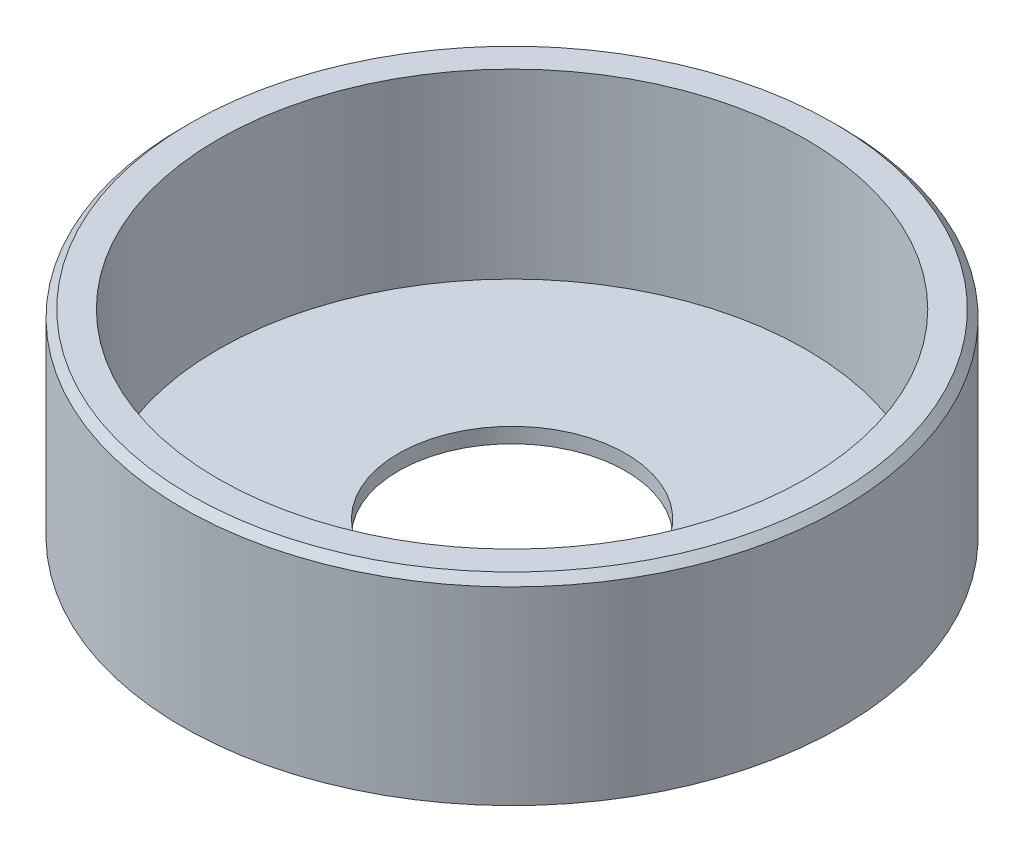
from build123d import *

# Parameters (mm, degrees)
SKETCH_1_R          = 43.5
EXTRUDE_1_DEPTH     = 26
SKETCH_2_R          = 38.8
CUT_EXTRUDE_1_DEPTH = 24
SKETCH_3_R          = 15
CUT_EXTRUDE_2_DEPTH = 67.034082109
CHAMFER_1_SIZE      = 1


with BuildPart() as part:
    # 草图1 → 凸台-拉伸1 (new body)
    with BuildSketch(Plane(origin=(0, 0, 0), x_dir=(1, 0, 0), z_dir=(0, 1, 0))):
        with Locations(Location((0, 0, 0), (0, 0, 90))):
            Circle(SKETCH_1_R)
    extrude(amount=EXTRUDE_1_DEPTH)

    # 草图2 → 切除-拉伸1 (cut)
    with BuildSketch(Plane(origin=(0, 26, 0), x_dir=(1, 0, 0), z_dir=(0, 1, 0))):
        with Locations(Location((0, 0, 0), (0, 0, 270))):
            Circle(SKETCH_2_R)
    extrude(amount=-CUT_EXTRUDE_1_DEPTH, mode=Mode.SUBTRACT)

    # 草图3 → 切除-拉伸2 (cut, through all)
    with BuildSketch(Plane(origin=(0, 2, 0), x_dir=(1, 0, 0), z_dir=(0, 1, 0))):
        with Locations(Location((0, 0, 0), (0, 0, 270))):
            Circle(SKETCH_3_R)
    extrude(amount=-CUT_EXTRUDE_2_DEPTH, mode=Mode.SUBTRACT)

    # 倒角1
    chamfer_1_edges = [part.edges().sort_by_distance(p)[0] for p in [
        (0, 26, 43.5),
    ]]
    chamfer(chamfer_1_edges, length=CHAMFER_1_SIZE)


solid = part.part
